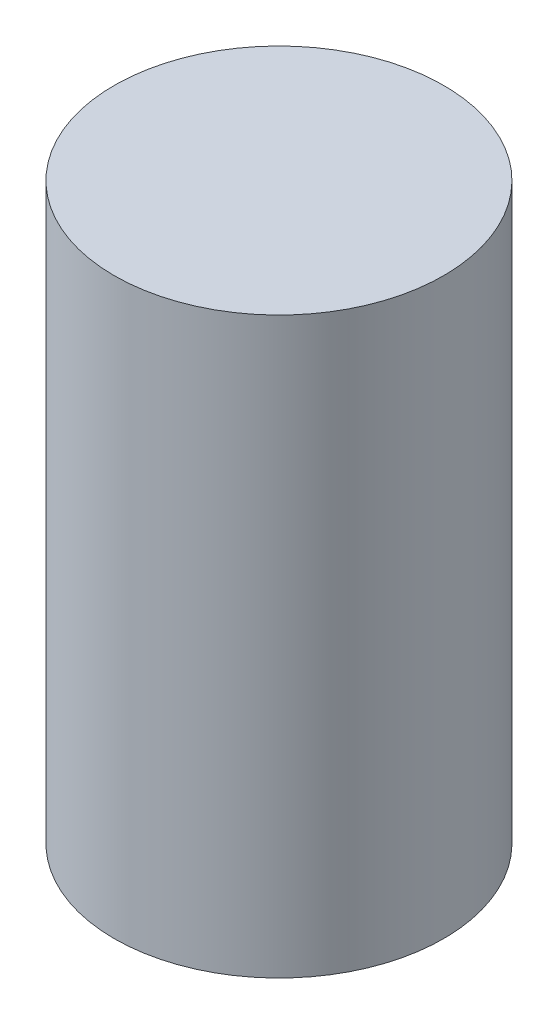
from build123d import *

# Parameters (mm, degrees)
SKETCH1_R           = 6.6
BOSS_EXTRUDE1_DEPTH = 23


with BuildPart() as part:
    # Sketch1 → Boss-Extrude1 (new body)
    with BuildSketch(Plane(origin=(0, 0, 0), x_dir=(1, 0, 0), z_dir=(0, 1, 0))):
        with Locations(Location((0, 0, 0), (0, 0, 270))):
            Circle(SKETCH1_R)
    extrude(amount=BOSS_EXTRUDE1_DEPTH)


solid = part.part
